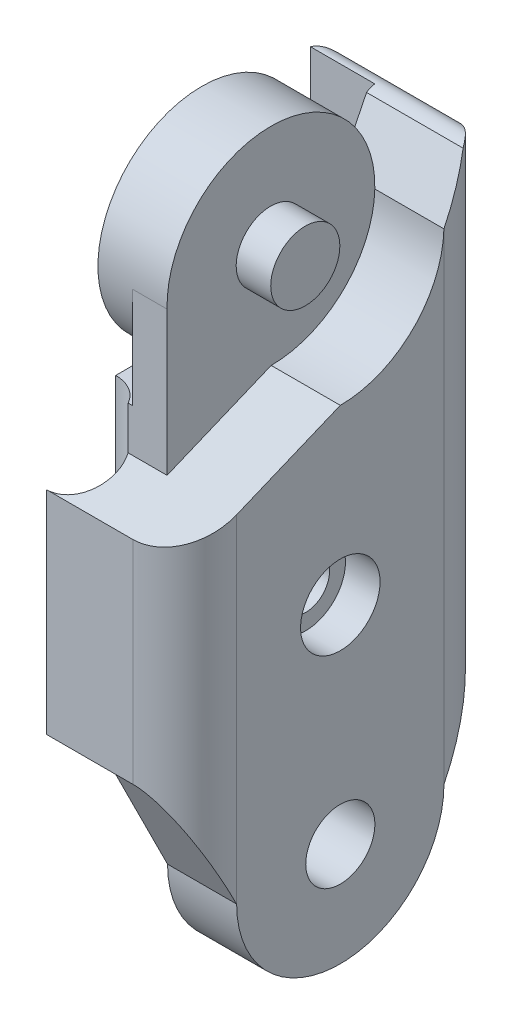
from build123d import *

# Parameters (mm, degrees)
BOSS_EXTRUDE1_DEPTH = 50.8
SKETCH3_R           = 1.27
CUT_EXTRUDE2_DEPTH  = 50.8
CUT_EXTRUDE1_DEPTH  = 50.8
CUT_EXTRUDE6_DEPTH  = 50.8
BOSS_EXTRUDE3_DEPTH = 20.32
SKETCH4_W           = 10.16
SKETCH4_H           = 15.24
CUT_EXTRUDE3_DEPTH  = 50.8
SKETCH5_R           = 2.54
CUT_EXTRUDE5_DEPTH  = 50.8
SKETCH8_R           = 2.54
BOSS_EXTRUDE2_DEPTH = 2.54
LPATTERN1_COUNT     = 2
LPATTERN1_PITCH     = 12.7
CUT_EXTRUDE7_DEPTH  = 20.32
SKETCH12_W          = 5.08
SKETCH12_H          = 19.941398178
CUT_EXTRUDE8_DEPTH  = 21.59
CUT_EXTRUDE9_DEPTH  = 5.08
LPATTERN2_COUNT     = 2
LPATTERN2_PITCH     = 15.24
CUT_EXTRUDE10_DEPTH = 40.767
BOSS_EXTRUDE4_START = 2.54
SKETCH16_R          = 7.638081415
BOSS_EXTRUDE4_DEPTH = 2.54
SKETCH17_R          = 2.54
CUT_EXTRUDE11_DEPTH = 2.54
SKETCH23_W          = 3.776239755
SKETCH23_H          = 7.410355269
CUT_EXTRUDE16_DEPTH = 2.54
CUT_EXTRUDE17_DEPTH = 9.906
SKETCH25_R          = 1.7526
CUT_EXTRUDE18_DEPTH = 20.828
SKETCH26_R          = 2.921
CUT_EXTRUDE19_DEPTH = 2.54


with BuildPart() as part:
    # Sketch1 → Boss-Extrude1 (new body)
    with BuildSketch(Plane(origin=(0, 0, 0), x_dir=(1, 0, 0), z_dir=(0, 1, 0))):
        with BuildLine():
            Line((-20.32, 27.095319289), (-20.32, 11.855319289))
            ThreePointArc((-20.32, 11.855319289), (-19.204076836, 9.161242453), (-16.51, 8.045319289))
            Line((-16.51, 8.045319289), (-3.81, 8.045319289))
            ThreePointArc((-3.81, 8.045319289), (-1.115923164, 9.161242453), (0, 11.855319289))
            Line((0, 11.855319289), (0, 27.095319289))
            ThreePointArc((0, 27.095319289), (-1.115923164, 29.789396126), (-3.81, 30.905319289))
            Line((-3.81, 30.905319289), (-16.51, 30.905319289))
            ThreePointArc((-16.51, 30.905319289), (-19.204076836, 29.789396126), (-20.32, 27.095319289))
        make_face()
    extrude(amount=BOSS_EXTRUDE1_DEPTH)

    # Sketch3 → Cut-Extrude2 (cut)
    with BuildSketch(Plane(origin=(0, 50.8, 0), x_dir=(1, 0, 0), z_dir=(0, 1, 0))):
        with Locations(Location((-10.16, 10.585319289, 0), (0, 0, 270))):
            Circle(SKETCH3_R)
        with Locations(Location((-10.16, 28.365319289, 0), (0, 0, 270))):
            Circle(SKETCH3_R)
    extrude(amount=-CUT_EXTRUDE2_DEPTH, mode=Mode.SUBTRACT)

    # Sketch2 → Cut-Extrude1 (cut)
    with BuildSketch(Plane.ZY.offset(20.32)):
        with BuildLine():
            Line((-27.095319289, 7.62), (-30.905319289, 15.24))
            Line((-30.905319289, 15.24), (-30.905319289, -5.08))
            Line((-30.905319289, -5.08), (-8.045319289, -5.08))
            Line((-8.045319289, -5.08), (-8.045319289, 15.24))
            Line((-8.045319289, 15.24), (-11.855319289, 7.62))
            ThreePointArc((-11.855319289, 7.62), (-19.475319289, 0), (-27.095319289, 7.62))
        make_face()
        with BuildLine():
            Line((-11.821559044, 42.970355269), (-8.045319289, 35.56))
            Line((-8.045319289, 35.56), (-8.045319289, 55.88))
            Line((-8.045319289, 55.88), (-30.905319289, 55.88))
            Line((-30.905319289, 55.88), (-30.905319289, 35.56))
            Line((-30.905319289, 35.56), (-27.092422036, 42.951560486))
            ThreePointArc((-27.092422036, 42.951560486), (-19.46663852, 50.799994215), (-11.821559044, 42.970355269))
        make_face()
    extrude(amount=-CUT_EXTRUDE1_DEPTH, mode=Mode.SUBTRACT)

    # Sketch7 → Cut-Extrude6 (cut)
    with BuildSketch(Plane.XY.offset(-8.045319289)):
        Polygon((-15.24, 50.8), (-12.7, 50.8), (-12.7, 35.56), (-7.62, 35.56), (-7.62, 50.8), (-5.08, 50.8), (-5.08, 35.56), (0, 35.56), (0, 59.156438057), (-20.32, 59.156438057), (-20.32, 35.56), (-15.24, 35.56), align=None)
    extrude(amount=-CUT_EXTRUDE6_DEPTH, mode=Mode.SUBTRACT)

    # Sketch9 → Boss-Extrude3 (add)
    with BuildSketch(Plane.ZY.offset(20.32)):
        with BuildLine():
            Line((-19.475319289, 35.56), (-30.961107471, 35.56))
            Line((-30.961107471, 35.56), (-30.961107471, 45.935432902))
            ThreePointArc((-30.961107471, 45.935432902), (-30.291229548, 47.014503778), (-29.026975399, 46.892882091))
            Line((-29.026975399, 46.892882091), (-27.092843326, 42.985764183))
            ThreePointArc((-27.092843326, 42.985764183), (-24.794356941, 37.723605727), (-19.475319289, 35.56))
        make_face()
    extrude(amount=-BOSS_EXTRUDE3_DEPTH)

    # Sketch4 → Cut-Extrude3 (cut)
    with BuildSketch(Plane.XY.offset(-8.045319289)):
        with Locations((-10.16, 7.62)):
            Rectangle(SKETCH4_W, SKETCH4_H)
    extrude(amount=-CUT_EXTRUDE3_DEPTH, mode=Mode.SUBTRACT)

    # Sketch5 → Cut-Extrude5 (cut)
    with BuildSketch(Plane.ZY.offset(20.32)):
        with Locations((-19.475319289, 7.62)):
            Circle(SKETCH5_R)
    extrude(amount=-CUT_EXTRUDE5_DEPTH, mode=Mode.SUBTRACT)

    # Sketch8 → Boss-Extrude2 (add)
    with BuildSketch(Plane.ZY.offset(15.24)):
        with Locations(Location((-19.441559044, 43.179995622, 0), (0, 0, 180))):
            Circle(SKETCH8_R)
    boss_extrude2 = extrude(amount=BOSS_EXTRUDE2_DEPTH)

    # LPattern1: Boss-Extrude2 ×2
    with Locations(*[(i * LPATTERN1_PITCH, 0, 0) for i in range(1, LPATTERN1_COUNT)]):
        add(boss_extrude2)

    # Sketch10 → Cut-Extrude7 (cut)
    with BuildSketch(Plane.XZ.offset(-35.56)):
        with BuildLine():
            Line((-16.51, -30.905319289), (-3.81, -30.905319289))
            ThreePointArc((-3.81, -30.905319289), (-1.115923164, -29.789396126), (0, -27.095319289))
            Line((0, -27.095319289), (5.770912039, -37.258829719))
            Line((5.770912039, -37.258829719), (-26.797758959, -37.890739908))
            Line((-26.797758959, -37.890739908), (-20.32, -27.095319289))
            ThreePointArc((-20.32, -27.095319289), (-19.204076836, -29.789396126), (-16.51, -30.905319289))
        make_face()
    extrude(amount=-CUT_EXTRUDE7_DEPTH, mode=Mode.SUBTRACT)

    # Sketch12 → Cut-Extrude8 (cut)
    with BuildSketch(Plane.XY.offset(-8.045319289)):
        with Locations((-10.16, 45.530699089)):
            Rectangle(SKETCH12_W, SKETCH12_H)
    extrude(amount=-CUT_EXTRUDE8_DEPTH, mode=Mode.SUBTRACT)

    # Sketch13 → Cut-Extrude9 (cut)
    with BuildSketch(Plane.ZY.offset(20.32)):
        Polygon((-19.475319289, 35.56), (-8.045319289, 30.82545932), (-1.320705488, 30.82545932), (-1.320705488, 35.56), align=None)
    cut_extrude9 = extrude(amount=-CUT_EXTRUDE9_DEPTH, mode=Mode.SUBTRACT)

    # LPattern2: Cut-Extrude9 ×2
    with Locations(*[(i * LPATTERN2_PITCH, 0, 0) for i in range(1, LPATTERN2_COUNT)]):
        add(cut_extrude9, mode=Mode.SUBTRACT)

    # Sketch15 → Cut-Extrude10 (cut, symmetric)
    with BuildSketch(Plane(origin=(0, 35.56, 0), x_dir=(1, 0, 0), z_dir=(0, 1, 0))):
        with BuildLine():
            Line((-10.16, 25.825319289), (-10.16, 13.125319289))
            ThreePointArc((-10.16, 13.125319289), (-7.62, 10.585319289), (-10.16, 8.045319289))
            Line((-10.16, 8.045319289), (-39.973745678, -4.467023153))
            Line((-39.973745678, -4.467023153), (-44.095820535, 43.963158694))
            Line((-44.095820535, 43.963158694), (-10.16, 30.905319289))
            ThreePointArc((-10.16, 30.905319289), (-12.7, 28.365319289), (-10.16, 25.825319289))
        make_face()
    extrude(amount=CUT_EXTRUDE10_DEPTH, both=True, mode=Mode.SUBTRACT)

    # Sketch16 → Boss-Extrude4 (add)
    with BuildSketch(Plane.ZY.offset(7.62).offset(BOSS_EXTRUDE4_START)):
        with Locations((-19.457237874, 43.161918585)):
            Circle(SKETCH16_R)
    extrude(amount=-BOSS_EXTRUDE4_DEPTH)

    # Sketch17 → Cut-Extrude11 (cut)
    with BuildSketch(Plane.ZY.offset(10.16)):
        with Locations((-19.457237874, 43.161918585)):
            Circle(SKETCH17_R)
    extrude(amount=-CUT_EXTRUDE11_DEPTH, mode=Mode.SUBTRACT)

    # Sketch23 → Cut-Extrude16 (cut)
    with BuildSketch(Plane(origin=(-5.08, 0, 0), x_dir=(0, 0, -1), z_dir=(1, 0, 0))):
        with Locations((9.933439167, 39.265177635)):
            Rectangle(SKETCH23_W, SKETCH23_H)
    extrude(amount=-CUT_EXTRUDE16_DEPTH, mode=Mode.SUBTRACT)

    # Sketch24 → Cut-Extrude17 (cut)
    with BuildSketch(Plane(origin=(-5.08, 0, 0), x_dir=(0, 0, -1), z_dir=(1, 0, 0))):
        Polygon((8.045319289, 35.56), (11.821559044, 35.56), (11.821559044, 32.38965536), (8.045319289, 30.82545932), align=None)
    extrude(amount=-CUT_EXTRUDE17_DEPTH, mode=Mode.SUBTRACT)

    # Sketch25 → Cut-Extrude18 (cut)
    with BuildSketch(Plane.ZY.offset(10.16)):
        with Locations((-19.475319289, 22.86)):
            Circle(SKETCH25_R)
    extrude(amount=-CUT_EXTRUDE18_DEPTH, mode=Mode.SUBTRACT)

    # Sketch26 → Cut-Extrude19 (cut)
    with BuildSketch(Plane(origin=(0, 0, 0), x_dir=(0, 0, -1), z_dir=(1, 0, 0))):
        with Locations((19.475319289, 22.86)):
            Circle(SKETCH26_R)
    extrude(amount=-CUT_EXTRUDE19_DEPTH, mode=Mode.SUBTRACT)


solid = part.part
